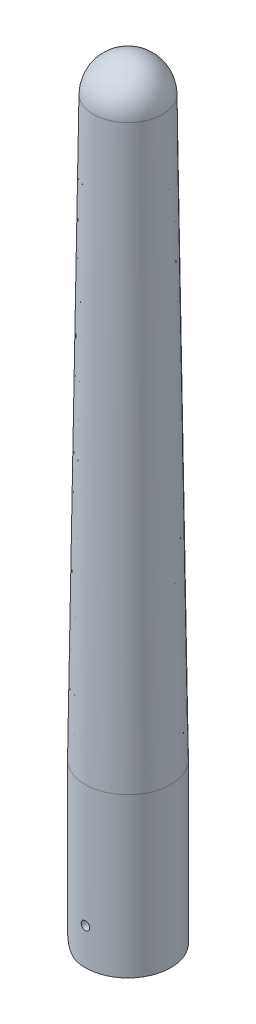
from build123d import *

# Parameters (mm, degrees)
CUT_EXTRUDE1_DEPTH      = 91.700053892
CUT_EXTRUDE1_DEPTH_BACK = 91.700053892
CUT_EXTRUDE2_DEPTH      = 91.700053903
CUT_EXTRUDE2_DEPTH_BACK = 91.700053903
SKETCH7_R               = 0.5
CUT_EXTRUDE3_DEPTH      = 6.5


with BuildPart() as part:
    # Sketch2 → Revolve1 (revolve)
    with BuildSketch(Plane.XY, mode=Mode.PRIVATE) as revolve1_sk:
        with BuildLine():
            Line((0, 0), (5, 0))
            Line((5, 0), (5, 19.05))
            Line((5, 19.05), (4.056413105, 86.424))
            ThreePointArc((4.056413105, 86.424), (2.848441999, 89.255803453), (0, 90.424))
            Line((0, 90.424), (0, 0))
        make_face()
    revolve(revolve1_sk.sketch.rotate(Axis((0, 0, 0), (0, 1, 0)), 90), axis=Axis((0, 0, 0), (0, 1, 0)))

    # Sketch6 → Cut-Extrude1 (cut, two sides: drawn at the far end of the back side and taken through both)
    with BuildSketch(Plane.XY.offset(-CUT_EXTRUDE1_DEPTH_BACK)):
        with BuildLine():
            Line((-4, 3.5), (-4, 7))
            Line((-4, 7), (-5, 8))
            Line((-5, 8), (-5, 0))
            Line((-5, 0), (5, 0))
            Line((5, 0), (5, 0.5))
            Line((5, 0.5), (-1, 0.5))
            ThreePointArc((-1, 0.5), (-3.121320344, 1.378679656), (-4, 3.5))
        make_face()
    extrude(amount=CUT_EXTRUDE1_DEPTH + CUT_EXTRUDE1_DEPTH_BACK, mode=Mode.SUBTRACT)

    # Sketch7 → Cut-Extrude2 (cut, two sides: drawn at the far end of the back side and taken through both)
    with BuildSketch(Plane.XY.offset(-CUT_EXTRUDE2_DEPTH_BACK)):
        with Locations((0, 4.7625)):
            Circle(SKETCH7_R)
    extrude(amount=CUT_EXTRUDE2_DEPTH + CUT_EXTRUDE2_DEPTH_BACK, mode=Mode.SUBTRACT)

    # Sketch8 → Cut-Extrude3 (cut)
    with BuildSketch(Plane.XZ.offset(-0.5)):
        with BuildLine():
            Line((0, 3), (-5, 3))
            Line((-5, 3), (-5, -3))
            Line((-5, -3), (0, -3))
            ThreePointArc((0, -3), (3, 0), (0, 3))
        make_face()
    extrude(amount=-CUT_EXTRUDE3_DEPTH, mode=Mode.SUBTRACT)


solid = part.part
